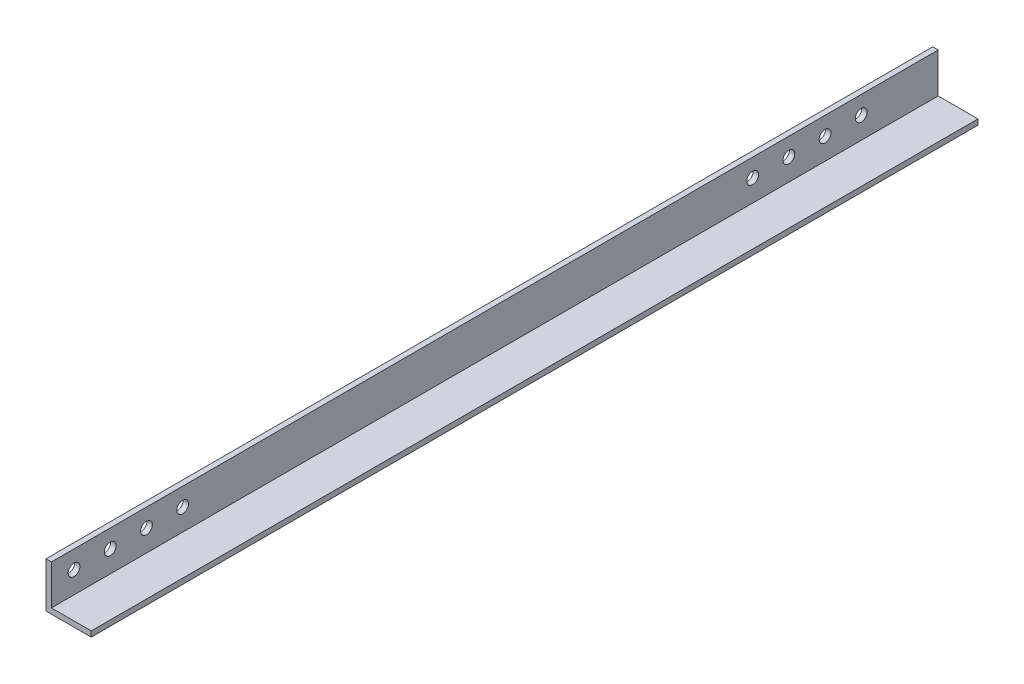
from build123d import *

# Parameters (mm, degrees)
SKETCH_1_W             = 100
SKETCH_1_H             = 100
EXTRUDE_1_DEPTH        = 1960
SKETCH_2_W             = 88
SKETCH_2_H             = 88
CUT_EXTRUDE_1_DEPTH    = 1966.095417531
SKETCH_3_R             = 13
CUT_EXTRUDE_2_DEPTH    = 1965.521315741
PATTERN_LINEAR_1_COUNT = 4
PATTERN_LINEAR_1_PITCH = 80
SKETCH_4_R             = 13
CUT_EXTRUDE_3_DEPTH    = 1965.521315741
PATTERN_LINEAR_2_COUNT = 4
PATTERN_LINEAR_2_PITCH = 80


with BuildPart() as part:
    # 草图1 → 凸台-拉伸1 (new body)
    with BuildSketch(Plane.XY):
        with Locations((50, 50)):
            Rectangle(SKETCH_1_W, SKETCH_1_H)
    extrude(amount=EXTRUDE_1_DEPTH)

    # 草图2 → 切除-拉伸1 (cut, through all)
    with BuildSketch(Plane.XY.offset(1960)):
        with Locations((56, 56)):
            Rectangle(SKETCH_2_W, SKETCH_2_H)
    extrude(amount=-CUT_EXTRUDE_1_DEPTH, mode=Mode.SUBTRACT)

    # 草图3 → 切除-拉伸2 (cut, through all)
    with BuildSketch(Plane(origin=(12, 0, 0), x_dir=(0, 0, -1), z_dir=(1, 0, 0))):
        with Locations(Location((-1910, 60, 0), (0, 0, 90))):
            Circle(SKETCH_3_R)
    cut_extrude_2 = extrude(amount=-CUT_EXTRUDE_2_DEPTH, mode=Mode.SUBTRACT)

    # 阵列(线性)1: 切除-拉伸2 ×4
    with Locations(*[(0, 0, -i * PATTERN_LINEAR_1_PITCH) for i in range(1, PATTERN_LINEAR_1_COUNT)]):
        add(cut_extrude_2, mode=Mode.SUBTRACT)

    # 草图4 → 切除-拉伸3 (cut, through all)
    with BuildSketch(Plane(origin=(12, 0, 0), x_dir=(0, 0, -1), z_dir=(1, 0, 0))):
        with Locations(Location((-170, 60, 0), (0, 0, 90))):
            Circle(SKETCH_4_R)
    cut_extrude_3 = extrude(amount=-CUT_EXTRUDE_3_DEPTH, mode=Mode.SUBTRACT)

    # 阵列(线性)2: 切除-拉伸3 ×4
    with Locations(*[(0, 0, i * PATTERN_LINEAR_2_PITCH) for i in range(1, PATTERN_LINEAR_2_COUNT)]):
        add(cut_extrude_3, mode=Mode.SUBTRACT)


solid = part.part
